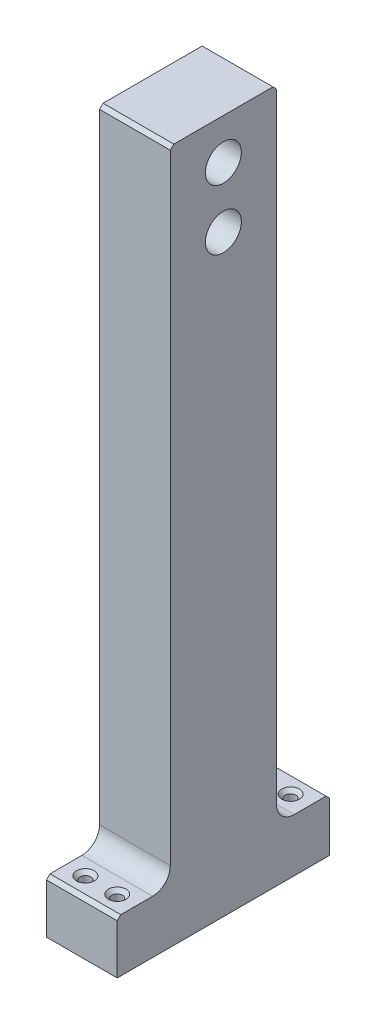
from build123d import *

# Parameters (mm, degrees)
SKETCH1_R           = 5.075
BOSS_EXTRUDE1_DEPTH = 20
CHAMFER1_SIZE       = 1
FILLET1_R           = 5
SKETCH2_R           = 1.5
CUT_EXTRUDE1_DEPTH  = 15
CHAMFER2_SIZE       = 1


with BuildPart() as part:
    # Sketch1 → Boss-Extrude1 (new body)
    with BuildSketch(Plane(origin=(0, 0, 0), x_dir=(0, 0, -1), z_dir=(1, 0, 0))):
        Polygon((0, 0), (60, 0), (60, 15), (45, 15), (45, 196.075), (15, 196.075), (15, 15), (0, 15), align=None)
        with Locations((30, 184.575)):
            Circle(SKETCH1_R, mode=Mode.SUBTRACT)
        with Locations((30, 167.575)):
            Circle(SKETCH1_R, mode=Mode.SUBTRACT)
    extrude(amount=BOSS_EXTRUDE1_DEPTH)

    # Chamfer1
    chamfer1_edges = [part.edges().sort_by_distance(p)[0] for p in [
        (10, 15, 0),
        (10, 196.075, -15),
        (10, 196.075, -45),
        (10, 15, -60),
    ]]
    chamfer(chamfer1_edges, length=CHAMFER1_SIZE)

    # Fillet1
    fillet1_edges = [part.edges().sort_by_distance(p)[0] for p in [
        (10, 15, -15),
        (10, 15, -45),
    ]]
    fillet(fillet1_edges, radius=FILLET1_R)

    # Sketch2 → Cut-Extrude1 (cut)
    with BuildSketch(Plane(origin=(0, 15, 0), x_dir=(1, 0, 0), z_dir=(0, 1, 0))):
        with Locations(Location((5.5, 54.5, 0), (0, 0, 270))):
            Circle(SKETCH2_R)
        with Locations(Location((14.5, 54.5, 0), (0, 0, 270))):
            Circle(SKETCH2_R)
        with Locations(Location((5.5, 5.5, 0), (0, 0, 270))):
            Circle(SKETCH2_R)
        with Locations(Location((14.5, 5.5, 0), (0, 0, 270))):
            Circle(SKETCH2_R)
    extrude(amount=-CUT_EXTRUDE1_DEPTH, mode=Mode.SUBTRACT)

    # Chamfer2
    chamfer2_edges = [part.edges().sort_by_distance(p)[0] for p in [
        (14.5, 15, -56),
        (5.5, 15, -7),
        (14.5, 15, -7),
        (5.5, 15, -56),
    ]]
    chamfer(chamfer2_edges, length=CHAMFER2_SIZE)


solid = part.part
